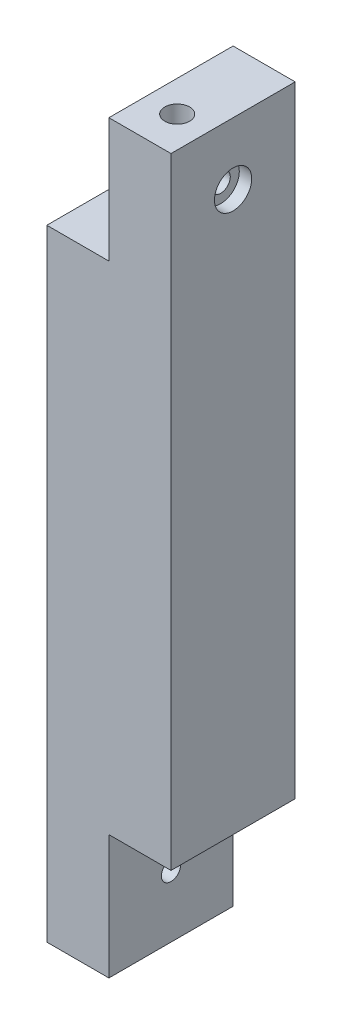
from build123d import *

# Parameters (mm, degrees)
SKETCH_1_W          = 20
SKETCH_1_H          = 20
EXTRUDE_1_DEPTH     = 120
SKETCH_2_W          = 10
SKETCH_2_H          = 20
CUT_EXTRUDE_1_DEPTH = 120
SKETCH_3_W          = 10
SKETCH_3_H          = 20
CUT_EXTRUDE_2_DEPTH = 120
CUT_EXTRUDE_3_DEPTH = 120
SKETCH_5_R          = 3
CUT_EXTRUDE_4_DEPTH = 2
CUT_EXTRUDE_5_DEPTH = 20
SKETCH_7_R          = 3
CUT_EXTRUDE_6_DEPTH = 2
SKETCH_8_R          = 2
CUT_EXTRUDE_7_DEPTH = 100


with BuildPart() as part:
    # 草图1 → 凸台-拉伸1 (new body)
    with BuildSketch(Plane(origin=(0, 0, 0), x_dir=(1, 0, 0), z_dir=(0, 1, 0))):
        with Locations((-7.981321578, -6.453869679)):
            Rectangle(SKETCH_1_W, SKETCH_1_H)
    extrude(amount=EXTRUDE_1_DEPTH)

    # 草图2 → 切除-拉伸1 (cut)
    with BuildSketch(Plane.XY.offset(16.453869679)):
        with Locations((-12.981321578, 110)):
            Rectangle(SKETCH_2_W, SKETCH_2_H)
    extrude(amount=-CUT_EXTRUDE_1_DEPTH, mode=Mode.SUBTRACT)

    # 草图3 → 切除-拉伸2 (cut)
    with BuildSketch(Plane.XY.offset(16.453869679)):
        with Locations((-2.981321578, 10)):
            Rectangle(SKETCH_3_W, SKETCH_3_H)
    extrude(amount=-CUT_EXTRUDE_2_DEPTH, mode=Mode.SUBTRACT)

    # 草图4 → 切除-拉伸3 (cut)
    with BuildSketch(Plane.ZY.offset(7.981321578)):
        with BuildLine():
            ThreePointArc((8.003869679, 110), (7.047028999, 111.432013275), (5.357854168, 111.096015511))
            Line((5.357854168, 111.096015511), (7.549885189, 108.903984489))
            ThreePointArc((7.549885189, 108.903984489), (7.885882954, 109.40684068), (8.003869679, 110))
        make_face()
        with BuildLine():
            Line((7.549885189, 108.903984489), (5.357854168, 111.096015511))
            ThreePointArc((5.357854168, 111.096015511), (5.357854168, 108.903984489), (7.549885189, 108.903984489))
        make_face()
    extrude(amount=-CUT_EXTRUDE_3_DEPTH, mode=Mode.SUBTRACT)

    # 草图5 → 切除-拉伸4 (cut)
    with BuildSketch(Plane(origin=(2.018678422, 0, 0), x_dir=(0, 0, -1), z_dir=(1, 0, 0))):
        with Locations((-6.453869679, 110)):
            Circle(SKETCH_5_R)
    extrude(amount=-CUT_EXTRUDE_4_DEPTH, mode=Mode.SUBTRACT)

    # 草图6 → 切除-拉伸5 (cut)
    with BuildSketch(Plane(origin=(-7.981321578, 0, 0), x_dir=(0, 0, -1), z_dir=(1, 0, 0))):
        with BuildLine():
            ThreePointArc((-4.903869679, 10), (-5.860710358, 11.432013275), (-7.549885189, 11.096015511))
            Line((-7.549885189, 11.096015511), (-5.357854168, 8.903984489))
            ThreePointArc((-5.357854168, 8.903984489), (-5.021856403, 9.40684068), (-4.903869679, 10))
        make_face()
        with BuildLine():
            Line((-5.357854168, 8.903984489), (-7.549885189, 11.096015511))
            ThreePointArc((-7.549885189, 11.096015511), (-7.549885189, 8.903984489), (-5.357854168, 8.903984489))
        make_face()
    extrude(amount=-CUT_EXTRUDE_5_DEPTH, mode=Mode.SUBTRACT)

    # 草图7 → 切除-拉伸6 (cut)
    with BuildSketch(Plane.ZY.offset(17.981321578)):
        with Locations((6.453869679, 10)):
            Circle(SKETCH_7_R)
    extrude(amount=-CUT_EXTRUDE_6_DEPTH, mode=Mode.SUBTRACT)

    # 草图8 → 切除-拉伸7 (cut)
    with BuildSketch(Plane.XZ.offset(-20)):
        with Locations(Location((-2.981321578, 10.453869679, 0), (0, 0, 270))):
            Circle(SKETCH_8_R)
    extrude(amount=-CUT_EXTRUDE_7_DEPTH, mode=Mode.SUBTRACT)


solid = part.part
